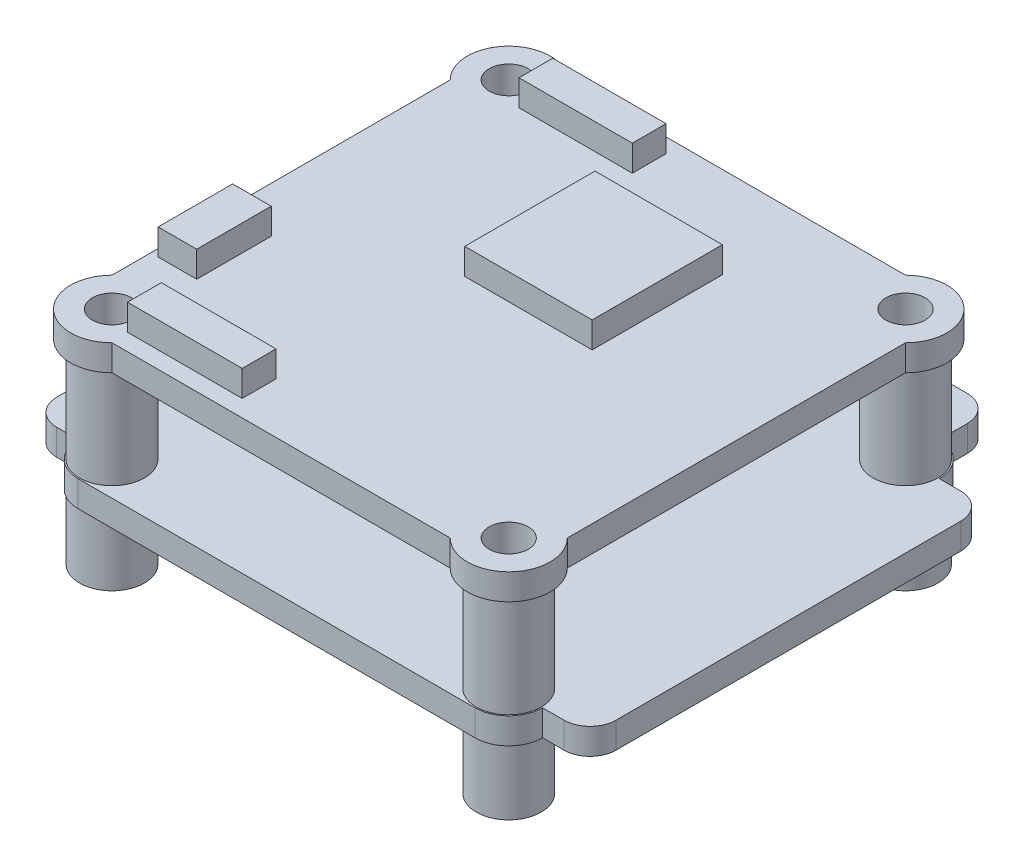
from build123d import *

# Parameters (mm, degrees)
EXTRUDE_1_DEPTH     = 2
SKETCH_2_R          = 2.5
EXTRUDE_2_DEPTH     = 5
EXTRUDE_START       = 8
SKETCH_3_R          = 2.5
EXTRUDE_3_DEPTH     = 8
EXTRUDE_4_DEPTH     = 2
CUT_EXTRUDE_1_DEPTH = 2
FILLET_1_R          = 2
SKETCH_6_W          = 8.710152629
SKETCH_6_H          = 2.597522262
SKETCH_6_W_2        = 2.966490945
SKETCH_6_H_2        = 5.729895294
SKETCH_6_W_3        = 8.81583313
SKETCH_6_H_3        = 2.597522261
SKETCH_6_W_4        = 9.797596015
SKETCH_6_H_4        = 10.014261194
EXTRUDE_5_DEPTH     = 2
SKETCH_7_R          = 1.5
CUT_EXTRUDE_2_DEPTH = 36.146123542


with BuildPart() as part:
    # 草图1 → 凸台-拉伸1 (new body)
    with BuildSketch(Plane(origin=(0, 0, 0), x_dir=(1, 0, 0), z_dir=(0, 1, 0))):
        Polygon((-21.5, -22), (-19.5, -22), (-19.5, -23), (19.5, -23), (19.5, -22), (21.5, -22), (21.5, 22), (-21.5, 22), align=None)
    extrude(amount=EXTRUDE_1_DEPTH)

    # 草图2 → 凸台-拉伸2 (add)
    with BuildSketch(Plane.XZ):
        with Locations(Location((-15.25, 15.25, 0), (0, 0, 90))):
            Circle(SKETCH_2_R)
        with Locations(Location((15.25, 15.25, 0), (0, 0, 90))):
            Circle(SKETCH_2_R)
        with Locations(Location((15.25, -15.25, 0), (0, 0, 90))):
            Circle(SKETCH_2_R)
        with Locations(Location((-15.25, -15.25, 0), (0, 0, 90))):
            Circle(SKETCH_2_R)
    extrude(amount=EXTRUDE_2_DEPTH)

    # 草图3 → 凸台-拉伸3 (add)
    with BuildSketch(Plane(origin=(0, 2, 0), x_dir=(1, 0, 0), z_dir=(0, 1, 0)).offset(EXTRUDE_START)):
        with Locations(Location((-15.25, 15.25, 0), (0, 0, 270))):
            Circle(SKETCH_3_R)
        with Locations(Location((15.25, 15.25, 0), (0, 0, 270))):
            Circle(SKETCH_3_R)
        with Locations(Location((15.25, -15.25, 0), (0, 0, 270))):
            Circle(SKETCH_3_R)
        with Locations(Location((-15.25, -15.25, 0), (0, 0, 270))):
            Circle(SKETCH_3_R)
    extrude(amount=-EXTRUDE_3_DEPTH)

    # 草图4 → 凸台-拉伸4 (add)
    with BuildSketch(Plane(origin=(0, 10, 0), x_dir=(1, 0, 0), z_dir=(0, 1, 0))):
        with BuildLine():
            Line((-13, 17.5), (13, 17.5))
            ThreePointArc((13, 17.5), (17.5, 17.5), (17.5, 13))
            Line((17.5, 13), (17.5, -13))
            ThreePointArc((17.5, -13), (17.5, -17.5), (13, -17.5))
            Line((13, -17.5), (-13, -17.5))
            ThreePointArc((-13, -17.5), (-17.5, -17.5), (-17.5, -13))
            Line((-17.5, -13), (-17.5, 13))
            ThreePointArc((-17.5, 13), (-17.5, 17.5), (-13, 17.5))
        make_face()
    extrude(amount=EXTRUDE_4_DEPTH)

    # 草图5 → 切除-拉伸1 (cut)
    with BuildSketch(Plane.XZ):
        with BuildLine():
            Line((15.25, 17.85), (-15.25, 17.85))
            ThreePointArc((-15.25, 17.85), (-17.088477631, 17.088477631), (-17.85, 15.25))
            Line((-17.85, 15.25), (-21.5, 15.25))
            Line((-21.5, 15.25), (-21.5, 22))
            Line((-21.5, 22), (-19.5, 22))
            Line((-19.5, 22), (-19.5, 23))
            Line((-19.5, 23), (19.5, 23))
            Line((19.5, 23), (19.5, 22))
            Line((19.5, 22), (21.5, 22))
            Line((21.5, 22), (21.5, 15.25))
            Line((21.5, 15.25), (17.85, 15.25))
            ThreePointArc((17.85, 15.25), (17.088477631, 17.088477631), (15.25, 17.85))
        make_face()
        with BuildLine():
            Line((21.5, -15.25), (17.85, -15.25))
            ThreePointArc((17.85, -15.25), (17.088477631, -17.088477631), (15.25, -17.85))
            Line((15.25, -17.85), (15.25, -22))
            Line((15.25, -22), (21.5, -22))
            Line((21.5, -22), (21.5, -15.25))
        make_face()
        with BuildLine():
            Line((-21.5, -15.25), (-17.85, -15.25))
            ThreePointArc((-17.85, -15.25), (-17.088477631, -17.088477631), (-15.25, -17.85))
            Line((-15.25, -17.85), (-15.25, -22))
            Line((-15.25, -22), (-21.5, -22))
            Line((-21.5, -22), (-21.5, -15.25))
        make_face()
    extrude(amount=-CUT_EXTRUDE_1_DEPTH, mode=Mode.SUBTRACT)

    # 圆角1
    fillet_1_edges = [part.edges().sort_by_distance(p)[0] for p in [
        (-21.5, 1, 15.25),
        (21.5, 1, 15.25),
        (21.5, 1, -15.25),
        (15.25, 1, -22),
        (-21.5, 1, -15.25),
        (-15.25, 1, -22),
    ]]
    fillet(fillet_1_edges, radius=FILLET_1_R)

    # 草图6 → 凸台-拉伸5 (add)
    with BuildSketch(Plane(origin=(0, 12, 0), x_dir=(1, 0, 0), z_dir=(0, 1, 0))):
        with Locations((-8.644923686, 15.086472233)):
            Rectangle(SKETCH_6_W, SKETCH_6_H)
        with Locations((-15.454766728, -7.149892581)):
            Rectangle(SKETCH_6_W_2, SKETCH_6_H_2)
        with Locations((-8.697763936, -14.903102968)):
            Rectangle(SKETCH_6_W_3, SKETCH_6_H_3)
        with Locations((1.034483131, 5.486228782)):
            Rectangle(SKETCH_6_W_4, SKETCH_6_H_4)
    extrude(amount=EXTRUDE_5_DEPTH)

    # 草图7 → 切除-拉伸2 (cut, through all)
    with BuildSketch(Plane(origin=(0, 12, 0), x_dir=(1, 0, 0), z_dir=(0, 1, 0))):
        with Locations(Location((-15.25, 15.25, 0), (0, 0, 270))):
            Circle(SKETCH_7_R)
        with Locations(Location((15.25, 15.25, 0), (0, 0, 270))):
            Circle(SKETCH_7_R)
        with Locations(Location((15.25, -15.25, 0), (0, 0, 270))):
            Circle(SKETCH_7_R)
        with Locations(Location((-15.25, -15.25, 0), (0, 0, 270))):
            Circle(SKETCH_7_R)
    extrude(amount=-CUT_EXTRUDE_2_DEPTH, mode=Mode.SUBTRACT)


solid = part.part
